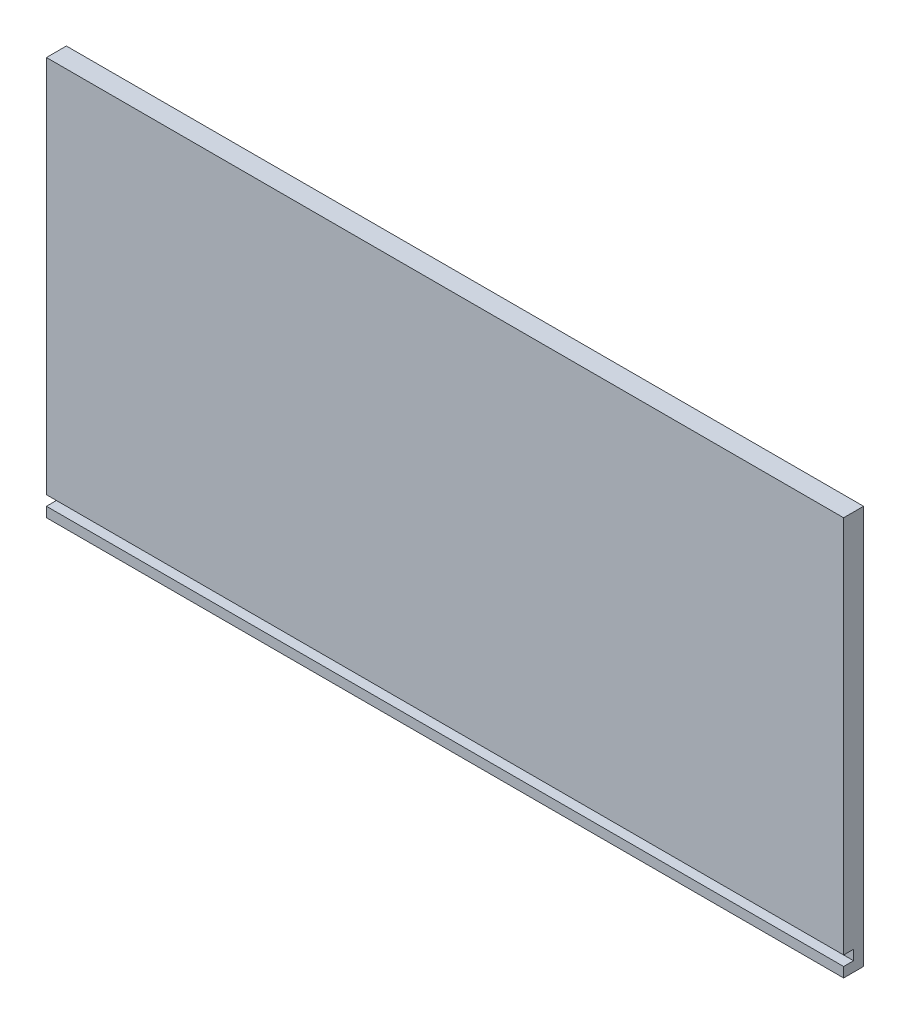
from build123d import *

# Parameters (mm, degrees)
SKETCH_1_W          = 400
SKETCH_1_H          = 200
EXTRUDE_1_DEPTH     = 10
SKETCH_2_W          = 400
SKETCH_2_H          = 5
CUT_EXTRUDE_1_DEPTH = 5


with BuildPart() as part:
    # ｽｹｯﾁ1 → ﾎﾞｽ - 押し出し1 (new body)
    with BuildSketch(Plane.XY):
        with Locations((130.719868277, 61.507142857)):
            Rectangle(SKETCH_1_W, SKETCH_1_H)
    extrude(amount=EXTRUDE_1_DEPTH)

    # ｽｹｯﾁ2 → ｶｯﾄ - 押し出し1 (cut)
    with BuildSketch(Plane.XY.offset(10)):
        with Locations((130.719868277, -30.992857143)):
            Rectangle(SKETCH_2_W, SKETCH_2_H)
    extrude(amount=-CUT_EXTRUDE_1_DEPTH, mode=Mode.SUBTRACT)


solid = part.part
